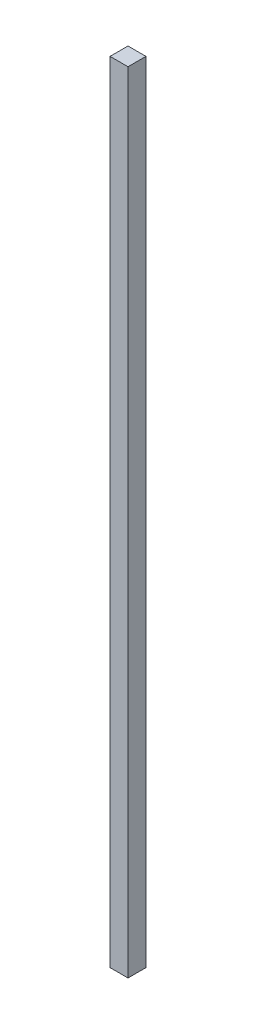
from build123d import *

# Parameters (mm, degrees)
SKETCH1_W           = 6.35
SKETCH1_H           = 6.35
BOSS_EXTRUDE1_DEPTH = 279.4


with BuildPart() as part:
    # Sketch1 → Boss-Extrude1 (new body)
    with BuildSketch(Plane(origin=(0, 0, 0), x_dir=(1, 0, 0), z_dir=(0, 1, 0))):
        with Locations((3.175, -3.175)):
            Rectangle(SKETCH1_W, SKETCH1_H)
    extrude(amount=BOSS_EXTRUDE1_DEPTH)


solid = part.part
